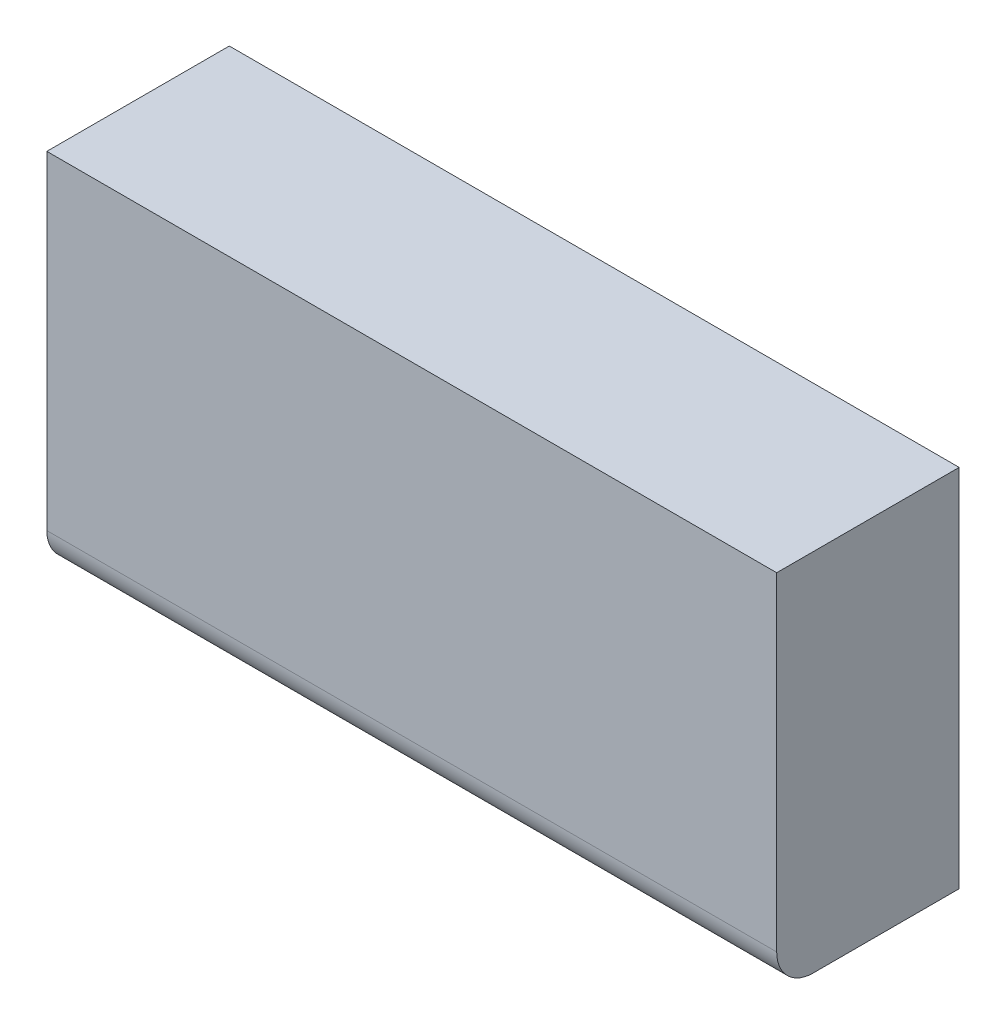
from build123d import *

# Parameters (mm, degrees)
SKETCH1_W           = 40
SKETCH1_H           = 20
BOSS_EXTRUDE1_DEPTH = 10
FILLET1_R           = 2


with BuildPart() as part:
    # Sketch1 → Boss-Extrude1 (new body)
    with BuildSketch(Plane.XY):
        with Locations((20, 10)):
            Rectangle(SKETCH1_W, SKETCH1_H)
    extrude(amount=BOSS_EXTRUDE1_DEPTH)

    # Fillet1
    fillet1_edges = [part.edges().sort_by_distance(p)[0] for p in [
        (20, 0, 10),
    ]]
    fillet(fillet1_edges, radius=FILLET1_R)


solid = part.part
